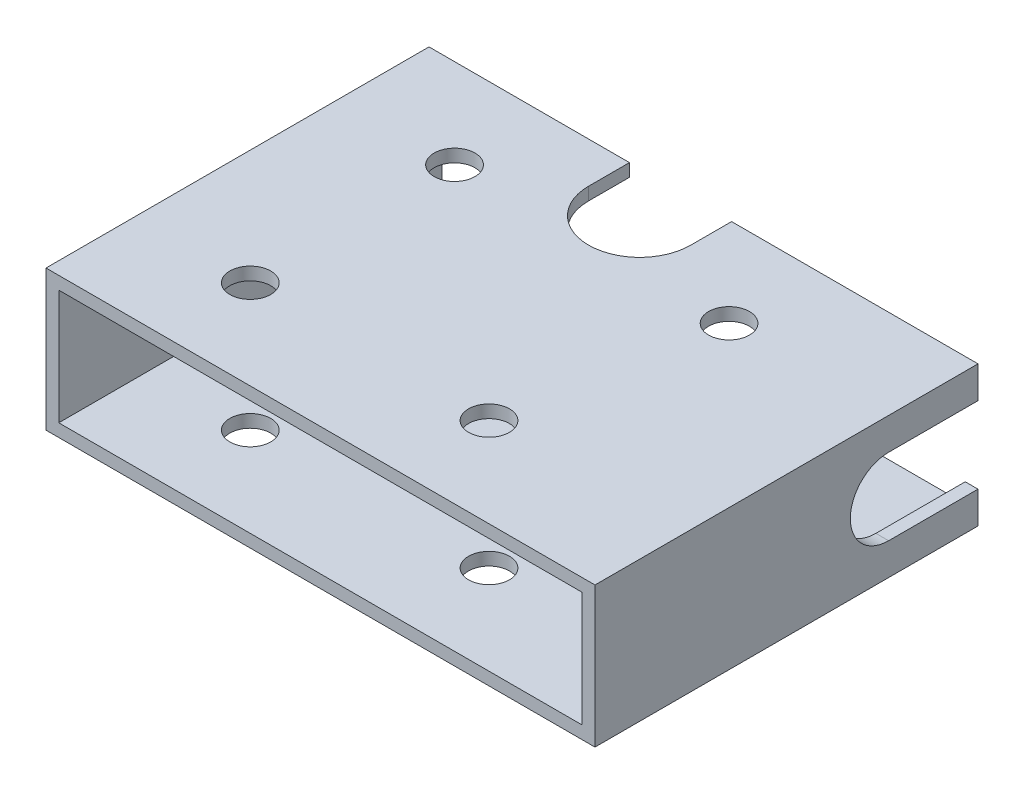
from build123d import *

# Parameters (mm, degrees)
SKETCH_2_W          = 41
SKETCH_2_H          = 9
EXTRUDE_1_DEPTH     = 30
SKETCH_3_R          = 1.6
CUT_EXTRUDE_1_DEPTH = 54.572380944
CUT_EXTRUDE_2_DEPTH = 3
CUT_EXTRUDE_3_DEPTH = 3
CUT_EXTRUDE_4_DEPTH = 3


with BuildPart() as part:
    # 草图2 → 凸台-拉伸1 (new body)
    with BuildSketch(Plane.XY):
        Polygon((0, 0), (-43, 0), (-43, 11), (0, 11), (0, 10), (0, 1), align=None)
        with Locations((-21.5, 5.5)):
            Rectangle(SKETCH_2_W, SKETCH_2_H, mode=Mode.SUBTRACT)
    extrude(amount=EXTRUDE_1_DEPTH)

    # 草图3 → 切除-拉伸1 (cut, through all)
    with BuildSketch(Plane(origin=(0, 11, 0), x_dir=(1, 0, 0), z_dir=(0, 1, 0))):
        with Locations(Location((-34, -7, 0), (0, 0, 270))):
            Circle(SKETCH_3_R)
        with Locations(Location((-34, -23, 0), (0, 0, 270))):
            Circle(SKETCH_3_R)
        with Locations(Location((-15.3, -23, 0), (0, 0, 270))):
            Circle(SKETCH_3_R)
        with Locations(Location((-12.5, -7, 0), (0, 0, 180))):
            Circle(SKETCH_3_R)
    extrude(amount=-CUT_EXTRUDE_1_DEPTH, mode=Mode.SUBTRACT)

    # 草图4 → 切除-拉伸2 (cut)
    with BuildSketch(Plane(origin=(0, 11, 0), x_dir=(1, 0, 0), z_dir=(0, 1, 0))):
        with BuildLine():
            Line((-19.3, 0), (-19.3, -3.2))
            ThreePointArc((-19.3, -3.2), (-23.3, -7.2), (-27.3, -3.2))
            Line((-27.3, -3.2), (-27.3, 0))
            Line((-27.3, 0), (-19.3, 0))
        make_face()
    extrude(amount=-CUT_EXTRUDE_2_DEPTH, mode=Mode.SUBTRACT)

    # 草图6 → 切除-拉伸3 (cut)
    with BuildSketch(Plane(origin=(0, 1, 0), x_dir=(1, 0, 0), z_dir=(0, 1, 0))):
        with BuildLine():
            Line((-28.3, -3.2), (-28.3, 0))
            Line((-28.3, 0), (-18.3, 0))
            Line((-18.3, 0), (-18.3, -3.2))
            ThreePointArc((-18.3, -3.2), (-23.3, -8.2), (-28.3, -3.2))
        make_face()
    extrude(amount=-CUT_EXTRUDE_3_DEPTH, mode=Mode.SUBTRACT)

    # 草图7 → 切除-拉伸4 (cut)
    with BuildSketch(Plane(origin=(0, 0, 0), x_dir=(0, 0, -1), z_dir=(1, 0, 0))):
        with BuildLine():
            Line((-7, 8.5), (0, 8.5))
            Line((0, 8.5), (0, 2.5))
            Line((0, 2.5), (-7, 2.5))
            ThreePointArc((-7, 2.5), (-10, 5.5), (-7, 8.5))
        make_face()
    extrude(amount=-CUT_EXTRUDE_4_DEPTH, mode=Mode.SUBTRACT)


solid = part.part
